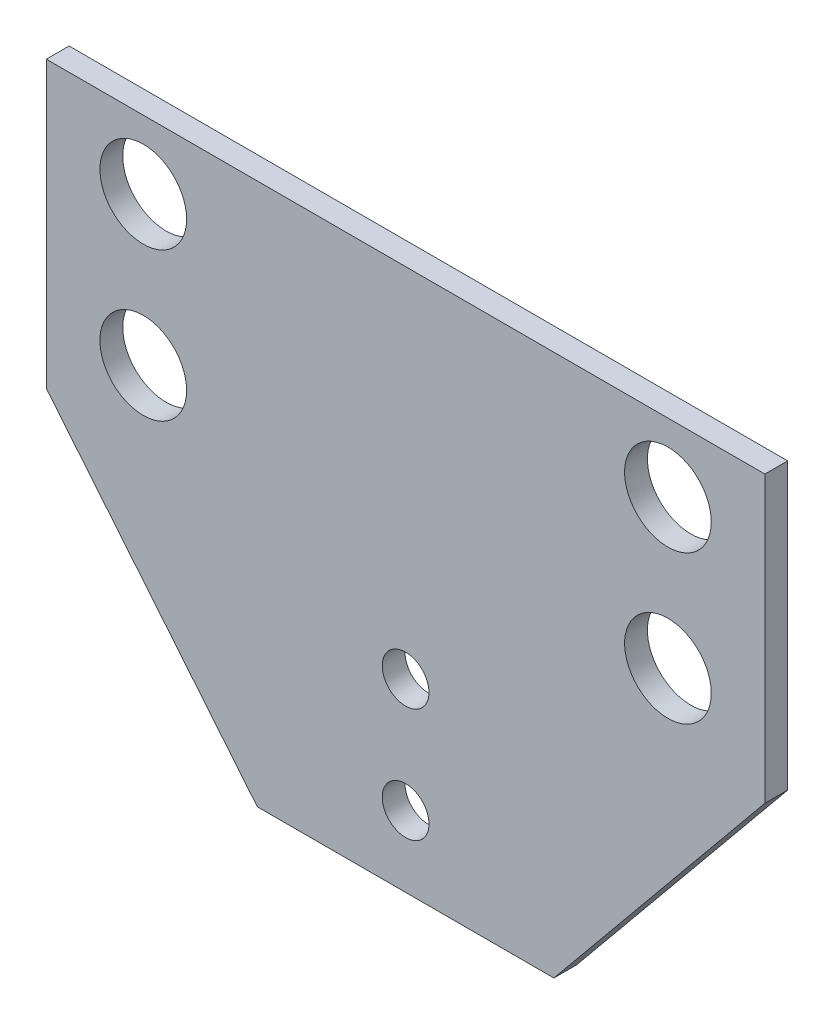
from build123d import *

# Parameters (mm, degrees)
SKETCH1_W           = 63
SKETCH1_H           = 25
SKETCH1_R           = 3.8
BOSS_EXTRUDE1_DEPTH = 2
SKETCH1_3_R         = 2.05
BOSS_EXTRUDE2_DEPTH = 2


with BuildPart() as part:
    # Sketch1 → Boss-Extrude1 (new body)
    with BuildSketch(Plane.XY):
        with Locations((0, -2.5)):
            Rectangle(SKETCH1_W, SKETCH1_H)
        with Locations((-23, -9)):
            Circle(SKETCH1_R, mode=Mode.SUBTRACT)
        with Locations((-23, 4)):
            Circle(SKETCH1_R, mode=Mode.SUBTRACT)
        with Locations((23, -9)):
            Circle(SKETCH1_R, mode=Mode.SUBTRACT)
        with Locations((23, 4)):
            Circle(SKETCH1_R, mode=Mode.SUBTRACT)
    extrude(amount=BOSS_EXTRUDE1_DEPTH)

    # Sketch1<3> → Boss-Extrude2 (add)
    with BuildSketch(Plane.XY):
        Polygon((13, -37.51566868), (31.5, -15), (-31.5, -15), (-13, -37.51566868), (0, -37.51566868), align=None)
        with Locations((0, -31.299955557)):
            Circle(SKETCH1_3_R, mode=Mode.SUBTRACT)
        with Locations((0, -21.322069584)):
            Circle(SKETCH1_3_R, mode=Mode.SUBTRACT)
    extrude(amount=BOSS_EXTRUDE2_DEPTH)


solid = part.part
